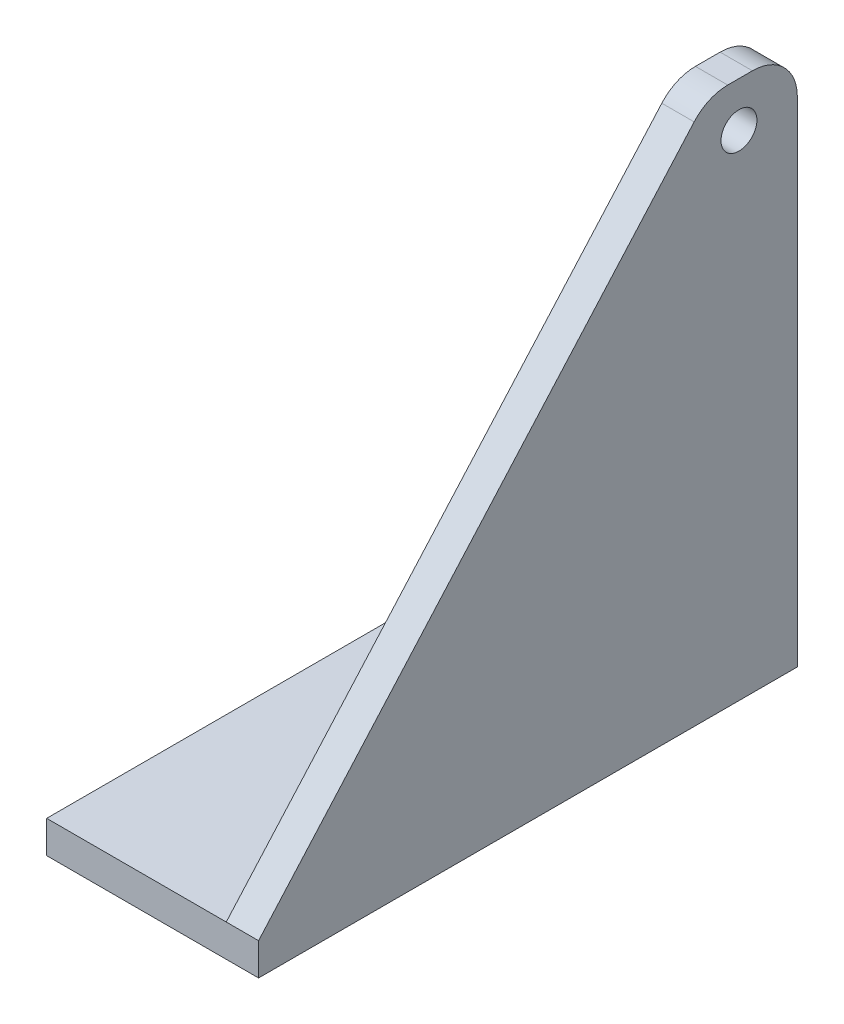
from build123d import *

# Parameters (mm, degrees)
SKETCH1_W           = 25.4
SKETCH1_H           = 4.572
BOSS_EXTRUDE1_DEPTH = 76.2
BOSS_EXTRUDE3_DEPTH = 4.572
FILLET3_R           = 6.35
SKETCH5_R           = 2.54
CUT_EXTRUDE2_DEPTH  = 112.853479088


with BuildPart() as part:
    # Sketch1 → Boss-Extrude1 (new body)
    with BuildSketch(Plane.XY):
        with Locations((12.7, 2.286)):
            Rectangle(SKETCH1_W, SKETCH1_H)
    extrude(amount=BOSS_EXTRUDE1_DEPTH)

    # Sketch4 → Boss-Extrude3 (add)
    with BuildSketch(Plane(origin=(25.4, 0, 0), x_dir=(0, 0, -1), z_dir=(1, 0, 0))):
        Polygon((-76.2, 0), (-76.2, 4.572), (-12.7, 76.2), (0, 76.2), (0, 0), align=None)
    extrude(amount=BOSS_EXTRUDE3_DEPTH)

    # Fillet3
    fillet3_edges = [part.edges().sort_by_distance(p)[0] for p in [
        (27.686, 76.2, 0),
        (27.686, 76.2, 12.7),
    ]]
    fillet(fillet3_edges, radius=FILLET3_R)

    # Sketch5 → Cut-Extrude2 (cut, through all)
    with BuildSketch(Plane(origin=(29.972, 0, 0), x_dir=(0, 0, -1), z_dir=(1, 0, 0))):
        with Locations((-8.255, 69.85)):
            Circle(SKETCH5_R)
    extrude(amount=-CUT_EXTRUDE2_DEPTH, mode=Mode.SUBTRACT)


solid = part.part
